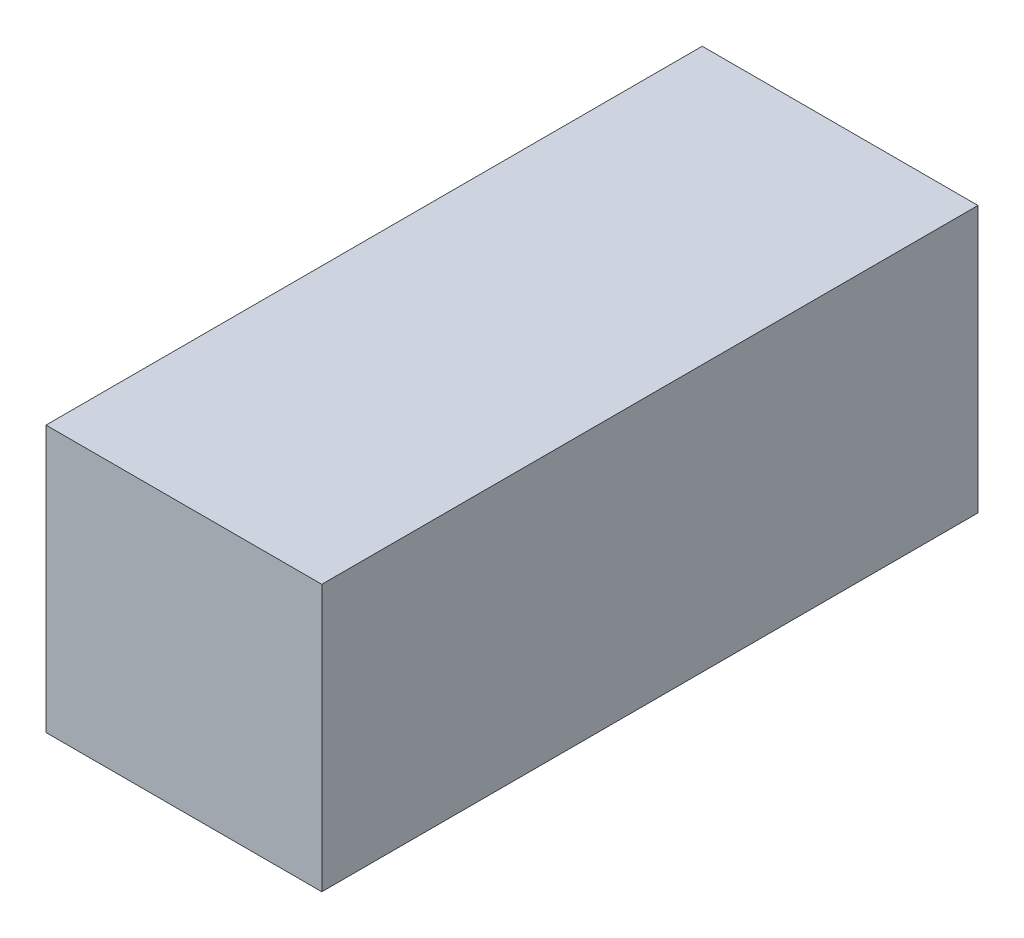
from build123d import *

# Parameters (mm, degrees)
SKETCH1_W           = 175.26
SKETCH1_H           = 71.12
BOSS_EXTRUDE1_DEPTH = 73.66


with BuildPart() as part:
    # Sketch1 → Boss-Extrude1 (new body)
    with BuildSketch(Plane(origin=(0, 0, 0), x_dir=(0, 0, -1), z_dir=(1, 0, 0))):
        with Locations((87.63, 35.56)):
            Rectangle(SKETCH1_W, SKETCH1_H)
    extrude(amount=BOSS_EXTRUDE1_DEPTH)


solid = part.part
